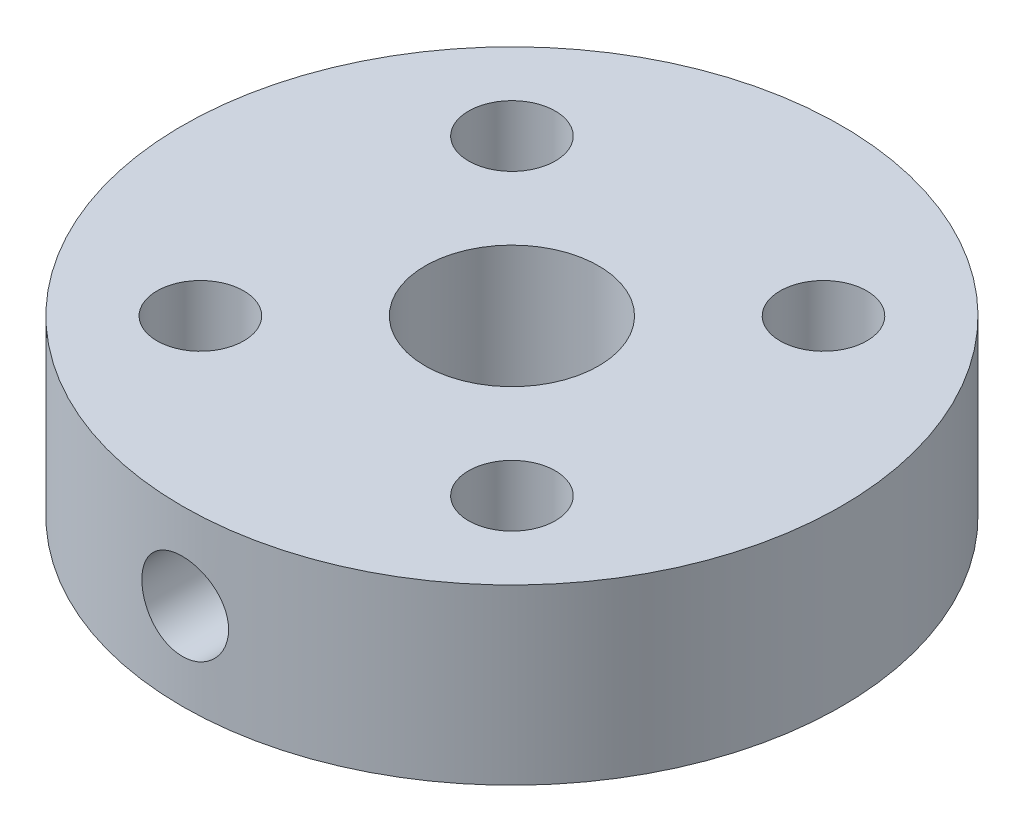
from build123d import *

# Parameters (mm, degrees)
SKETCH1_R                 = 9.5
BOSS_EXTRUDE1_DEPTH       = 5
F_5_0MM_DOWEL_HOLE1_D     = 5
M3X0_5_TAPPED_HOLE1_D     = 2.5
M3X0_5_TAPPED_HOLE2_D     = 2.5
M3X0_5_TAPPED_HOLE2_DEPTH = 10
M3X0_5_TAPPED_HOLE2_TIP   = 0.751075774


with BuildPart() as part:
    # Sketch1 → Boss-Extrude1 (new body)
    with BuildSketch(Plane(origin=(0, 0, 0), x_dir=(1, 0, 0), z_dir=(0, 1, 0))):
        with Locations(Location((0, 0, 0), (0, 0, 270))):
            Circle(SKETCH1_R)
    extrude(amount=BOSS_EXTRUDE1_DEPTH)

    # Ø5.0mm Dowel Hole1 (through all)
    with Locations(Plane(origin=(0, 5, 0), x_dir=(1, 0, 0), z_dir=(0, 1, 0))):
        with Locations((0, 0)):
            Hole(F_5_0MM_DOWEL_HOLE1_D / 2)

    # M3x0.5 Tapped Hole1 (through all)
    with Locations(Plane(origin=(0, 5, 0), x_dir=(1, 0, 0), z_dir=(0, 1, 0))):
        with Locations((4.490128061, 4.490128061), (-4.490128061, 4.490128061), (-4.490128061, -4.490128061), (4.490128061, -4.490128061)):
            Hole(M3X0_5_TAPPED_HOLE1_D / 2)

    # M3x0.5 Tapped Hole2
    with Locations(Plane(origin=(0, 2.5, 9.5), x_dir=(1, 0, 0), z_dir=(0, 0, 1))):
        with Locations((0, 0)):
            Hole(M3X0_5_TAPPED_HOLE2_D / 2, depth=M3X0_5_TAPPED_HOLE2_DEPTH)
            with Locations((0, 0, -(M3X0_5_TAPPED_HOLE2_DEPTH + M3X0_5_TAPPED_HOLE2_TIP / 2))):  # 118° drill point
                Cone(0, M3X0_5_TAPPED_HOLE2_D / 2, M3X0_5_TAPPED_HOLE2_TIP, mode=Mode.SUBTRACT)


solid = part.part
